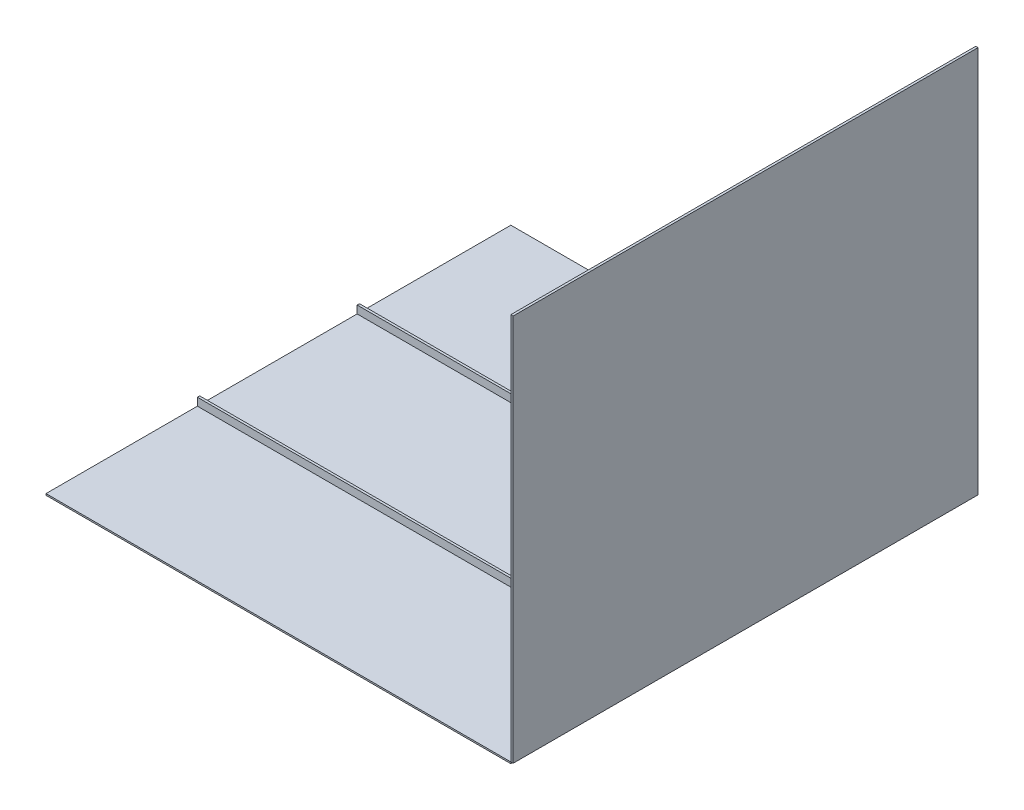
from build123d import *

# Parameters (mm, degrees)
SKETCH_1_W      = 600
SKETCH_1_H      = 600
EXTRUDE_1_DEPTH = 2
SKETCH_2_W      = 3
SKETCH_2_H      = 600
EXTRUDE_2_DEPTH = 500
SKETCH_4_W      = 592.256000526
SKETCH_4_H      = 3
SKETCH_4_W_2    = 599.287070966
EXTRUDE_6_DEPTH = 10


with BuildPart() as part:
    # 草图1 → 凸台-拉伸1 (new body)
    with BuildSketch(Plane(origin=(0, 0, 0), x_dir=(1, 0, 0), z_dir=(0, 1, 0))):
        Rectangle(SKETCH_1_W, SKETCH_1_H)
    extrude(amount=EXTRUDE_1_DEPTH)

    # 草图4 → 凸台-拉伸6 (add)
    with BuildSketch(Plane(origin=(0, 2, 0), x_dir=(1, 0, 0), z_dir=(0, 1, 0))):
        with Locations((-3.871999737, 103.1)):
            Rectangle(SKETCH_4_W, SKETCH_4_H)
        with Locations((-0.356464517, -103.1)):
            Rectangle(SKETCH_4_W_2, SKETCH_4_H)
    extrude(amount=EXTRUDE_6_DEPTH)


with BuildPart() as body_2:
    # 草图2 → 凸台-拉伸2 (new body)
    with BuildSketch(Plane(origin=(0, 2, 0), x_dir=(1, 0, 0), z_dir=(0, 1, 0))):
        with Locations((301.5, 0)):
            Rectangle(SKETCH_2_W, SKETCH_2_H)
    extrude(amount=EXTRUDE_2_DEPTH)


solid = Compound([part.part, body_2.part])
